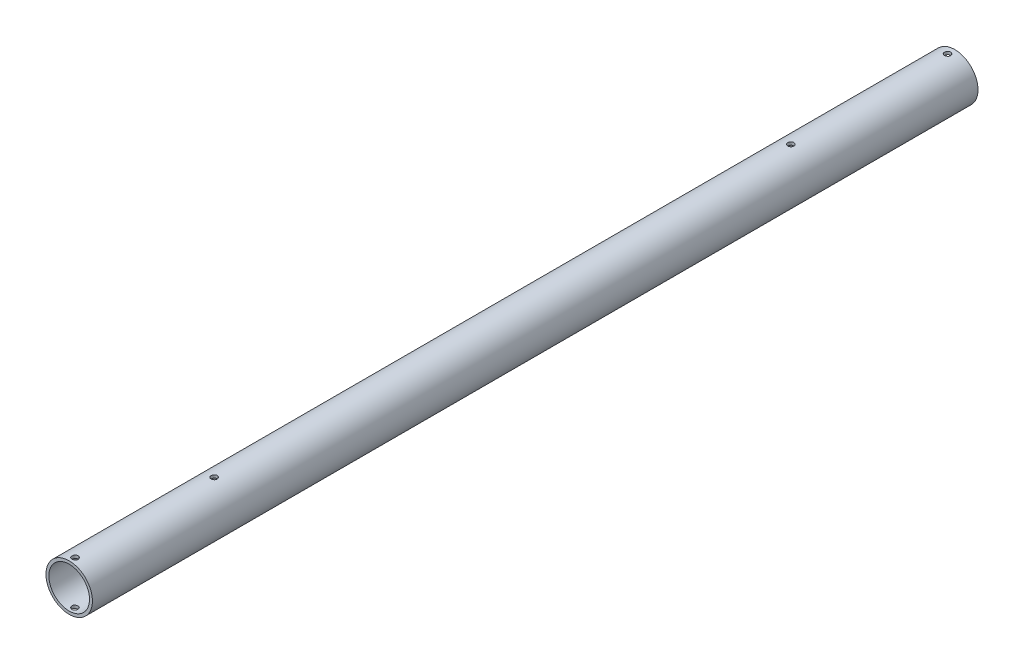
from build123d import *

# Parameters (mm, degrees)
SKETCH1_R           = 8
SKETCH1_R_2         = 7
BOSS_EXTRUDE1_DEPTH = 305
SKETCH2_R           = 1.05
CUT_EXTRUDE2_DEPTH  = 20


with BuildPart() as part:
    # Sketch1 → Boss-Extrude1 (new body)
    with BuildSketch(Plane.XY):
        Circle(SKETCH1_R)
        Circle(SKETCH1_R_2, mode=Mode.SUBTRACT)
    extrude(amount=BOSS_EXTRUDE1_DEPTH)

    # Sketch2 → Cut-Extrude2 (cut)
    with BuildSketch(Plane.XZ.offset(10)):
        with Locations(Location((0, 2.5, 0), (0, 0, 270))):
            Circle(SKETCH2_R)
        with Locations(Location((0, 56.5, 0), (0, 0, 270))):
            Circle(SKETCH2_R)
        with Locations(Location((0, 255.1, 0), (0, 0, 270))):
            Circle(SKETCH2_R)
        with Locations(Location((0, 303, 0), (0, 0, 270))):
            Circle(SKETCH2_R)
    extrude(amount=-CUT_EXTRUDE2_DEPTH, mode=Mode.SUBTRACT)


solid = part.part
